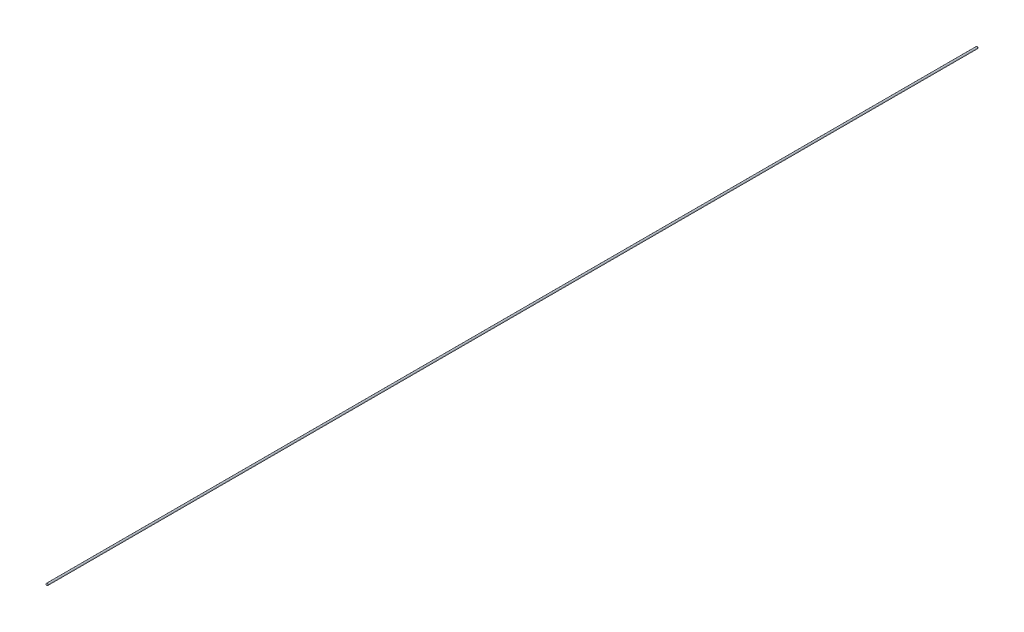
from build123d import *

# Parameters (mm, degrees)
SKETCH3_R           = 0.5
BOSS_EXTRUDE1_DEPTH = 250
FILLET1_R           = 0.4


with BuildPart() as part:
    # Sketch3 → Boss-Extrude1 (new, symmetric)
    with BuildSketch(Plane.XY):
        Circle(SKETCH3_R)
    extrude(amount=BOSS_EXTRUDE1_DEPTH, both=True)

    # Fillet1
    fillet1_edges = [part.edges().sort_by_distance(p)[0] for p in [
        (-0.5, 0, -250),
        (-0.5, 0, 250),
    ]]
    fillet(fillet1_edges, radius=FILLET1_R)


solid = part.part
